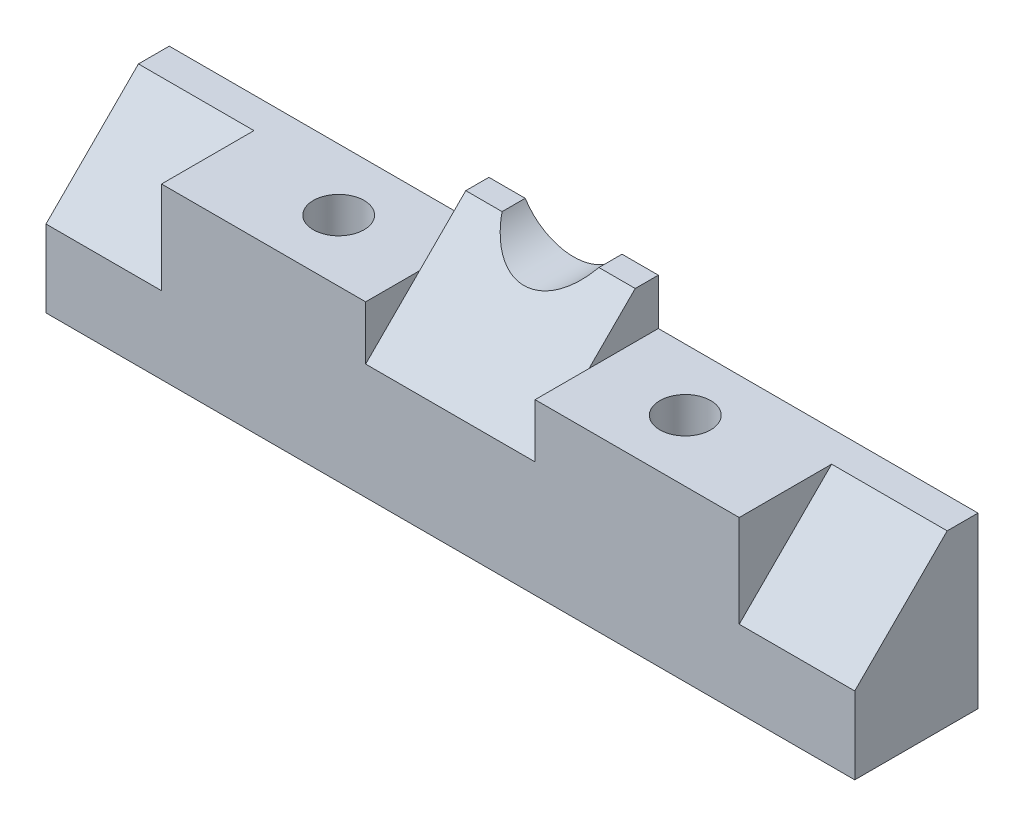
from build123d import *

# Parameters (mm, degrees)
CROQUIS1_W                                   = 105
CROQUIS1_H                                   = 22
SALIENTE_EXTRUIR1_DEPTH                      = 16
CORTAR_EXTRUIR2_DEPTH                        = 15
CORTAR_EXTRUIR3_START                        = -105
CORTAR_EXTRUIR3_DEPTH                        = 15
CROQUIS3_W                                   = 22
CROQUIS3_H                                   = 14
CORTAR_EXTRUIR4_DEPTH                        = 109.466584716
SALIENTE_EXTRUIR3_DEPTH                      = 22
CROQUIS5_R                                   = 7.45
CORTAR_EXTRUIR6_DEPTH                        = 15
REFRENTADO_PARA_TORNILLO_TAP_N_CON_C_2_COUNT = 2
REFRENTADO_PARA_TORNILLO_TAP_N_CON_C_2_PITCH = 45


with BuildPart() as part:
    # Croquis1 → Saliente-Extruir1 (new body)
    with BuildSketch(Plane.XY):
        with Locations((52.5, 11)):
            Rectangle(CROQUIS1_W, CROQUIS1_H)
    extrude(amount=SALIENTE_EXTRUIR1_DEPTH)

    # Croquis2 → Cortar-Extruir2 (cut)
    with BuildSketch(Plane(origin=(105, 0, 0), x_dir=(0, 0, -1), z_dir=(1, 0, 0))):
        Polygon((-16, 10), (-16, 22), (-4, 22), align=None)
    extrude(amount=-CORTAR_EXTRUIR2_DEPTH, mode=Mode.SUBTRACT)

    # Croquis2<2> → Cortar-Extruir3 (cut)
    with BuildSketch(Plane(origin=(105, 0, 0), x_dir=(0, 0, -1), z_dir=(1, 0, 0)).offset(CORTAR_EXTRUIR3_START)):
        Polygon((-16, 10), (-16, 22), (-4, 22), align=None)
    extrude(amount=CORTAR_EXTRUIR3_DEPTH, mode=Mode.SUBTRACT)

    # Croquis3 → Cortar-Extruir4 (cut, through all)
    with BuildSketch(Plane.XY.offset(16)):
        with Locations((52.5, 22)):
            Rectangle(CROQUIS3_W, CROQUIS3_H)
    extrude(amount=-CORTAR_EXTRUIR4_DEPTH, mode=Mode.SUBTRACT)

    # Croquis4 → Saliente-Extruir3 (add)
    with BuildSketch(Plane(origin=(41.5, 0, 0), x_dir=(0, 0, -1), z_dir=(1, 0, 0))):
        Polygon((-16, 15), (-3, 28), (0, 28), (0, 15), align=None)
    extrude(amount=SALIENTE_EXTRUIR3_DEPTH)

    # Croquis5 → Cortar-Extruir6 (cut)
    with BuildSketch(Plane(origin=(0, 0, 0), x_dir=(-1, 0, 0), z_dir=(0, 0, -1))):
        with Locations((-52.5, 32)):
            Circle(CROQUIS5_R)
    extrude(amount=-CORTAR_EXTRUIR6_DEPTH, mode=Mode.SUBTRACT)

    # Croquis9 → Refrentado para tornillo tapón con cabeza de clavija de M61 (revolve, cut)
    with BuildSketch(Plane(origin=(30, 0, 8), x_dir=(0, 0, -1), z_dir=(1, 0, 0))):
        Polygon((0, 0), (0, 28), (3.3, 28), (3.3, 6), (5.5, 6), (5.5, 0.025), (5.525, 0), align=None)
    refrentado_para_tornillo_tap_n_con_cabez = revolve(axis=Axis((30, -6.35, 8), (0, 1, 0)), mode=Mode.SUBTRACT)

    # Refrentado para tornillo tap_n con c 2: Refrentado para tornillo tapón con cabeza de clavija de M61 ×2
    with Locations(*[(i * REFRENTADO_PARA_TORNILLO_TAP_N_CON_C_2_PITCH, 0, 0) for i in range(1, REFRENTADO_PARA_TORNILLO_TAP_N_CON_C_2_COUNT)]):
        add(refrentado_para_tornillo_tap_n_con_cabez, mode=Mode.SUBTRACT)


solid = part.part
